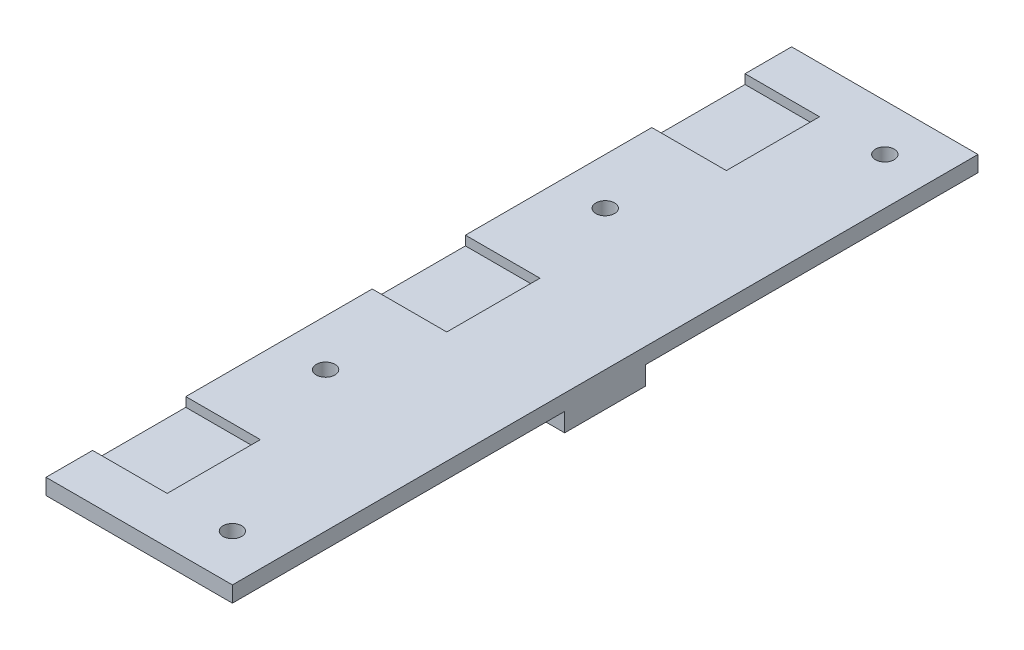
from build123d import *

# Parameters (mm, degrees)
SKETCH_1_W          = 20
SKETCH_1_H          = 80
SKETCH_1_R          = 1
EXTRUDE_1_DEPTH     = 1.7
SKETCH_2_W          = 8
SKETCH_2_H          = 10
CUT_EXTRUDE_1_DEPTH = 1
SKETCH_3_W          = 5.4
SKETCH_3_H          = 8.7
EXTRUDE_2_DEPTH     = 2


with BuildPart() as part:
    # 草图1 → 凸台-拉伸1 (new body)
    with BuildSketch(Plane(origin=(0, 0, 0), x_dir=(1, 0, 0), z_dir=(0, 1, 0))):
        Rectangle(SKETCH_1_W, SKETCH_1_H)
        with Locations(Location((-5, 15, 0), (0, 0, 270))):
            Circle(SKETCH_1_R, mode=Mode.SUBTRACT)
        with Locations(Location((-5, -15, 0), (0, 0, 270))):
            Circle(SKETCH_1_R, mode=Mode.SUBTRACT)
        with Locations(Location((5, 35, 0), (0, 0, 270))):
            Circle(SKETCH_1_R, mode=Mode.SUBTRACT)
        with Locations(Location((5, -35, 0), (0, 0, 270))):
            Circle(SKETCH_1_R, mode=Mode.SUBTRACT)
    extrude(amount=EXTRUDE_1_DEPTH)

    # 草图2 → 切除-拉伸1 (cut)
    with BuildSketch(Plane(origin=(0, 1.7, 0), x_dir=(1, 0, 0), z_dir=(0, 1, 0))):
        with Locations((-6, -30)):
            Rectangle(SKETCH_2_W, SKETCH_2_H)
        with Locations((-6, 0)):
            Rectangle(SKETCH_2_W, SKETCH_2_H)
        with Locations((-6, 30)):
            Rectangle(SKETCH_2_W, SKETCH_2_H)
    extrude(amount=-CUT_EXTRUDE_1_DEPTH, mode=Mode.SUBTRACT)

    # 草图3 → 凸台-拉伸2 (add)
    with BuildSketch(Plane.XZ):
        with Locations((7.3, 0)):
            Rectangle(SKETCH_3_W, SKETCH_3_H)
    extrude(amount=EXTRUDE_2_DEPTH)


solid = part.part
